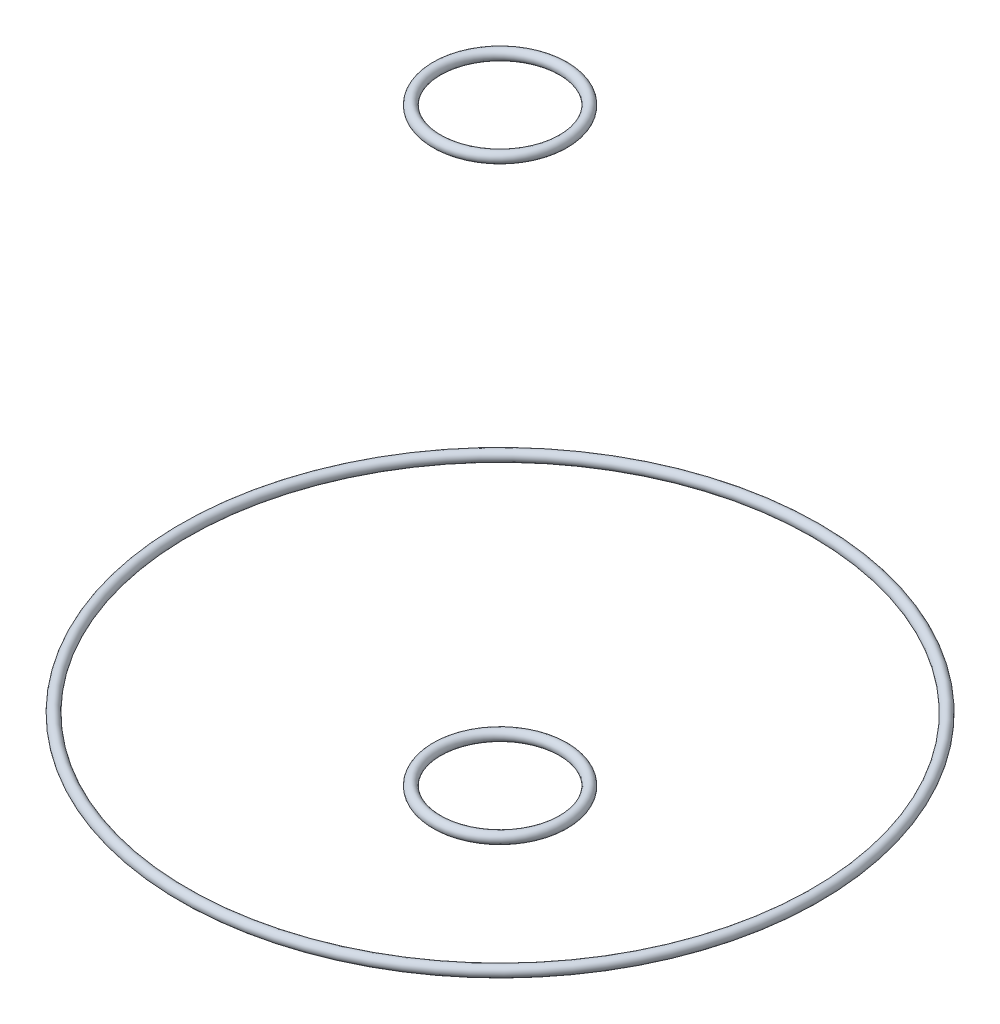
from build123d import *

# Parameters (mm, degrees)
SKETCH1_R = 12.7


with BuildPart() as part:
    # Sketch1 → Revolve1 (revolve)
    with BuildSketch(Plane.XY, mode=Mode.PRIVATE) as revolve1_sk:
        with Locations((762, 0)):
            Circle(SKETCH1_R)
        with Locations((152.4, -152.4)):
            Circle(SKETCH1_R)
        with Locations((152.4, 1270)):
            Circle(SKETCH1_R)
    revolve(revolve1_sk.sketch.rotate(Axis((0, 0, 0), (0, 1, 0)), 90), axis=Axis((0, 0, 0), (0, 1, 0)))


solid = part.part
